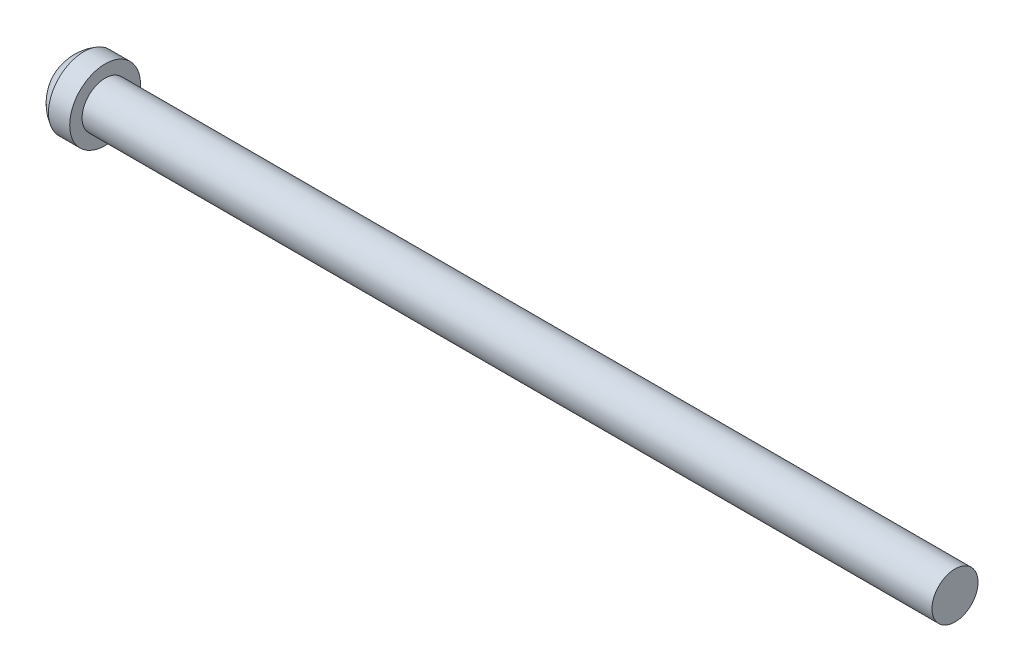
from build123d import *

# Parameters (mm, degrees)
SKIZZE3_R                       = 3.25
SKIZZE4_R                       = 5
AUFSATZ_LINEAR_AUSTRAGEN3_DEPTH = 3
KUPPEL1_FACE_RADIUS             = 5
KUPPEL1_HEIGHT                  = 3


with BuildPart() as part:
    # Austragung1: sweep along a path in Skizze2
    with BuildLine(Plane(origin=(-60, 0, 0), x_dir=(-1, 0, 0), z_dir=(0, 0, 1))) as austragung1_path:
        Line((60, 31.561162316), (-60, 31.561162316))
    # Skizze3 → Austragung1 (sweep)
    with BuildSketch(Plane(origin=(-120, 0, 0), x_dir=(0, -1, 0), z_dir=(-1, 0, 0))):
        with Locations((60, 5)):
            Circle(SKIZZE3_R)
    sweep(path=austragung1_path.line)

    # Skizze4 → Aufsatz-Linear austragen3 (add)
    with BuildSketch(Plane(origin=(-120, 0, 0), x_dir=(0, -1, 0), z_dir=(-1, 0, 0))):
        with Locations(Location((60, 5, 0), (0, 0, 90))):
            Circle(SKIZZE4_R)
    extrude(amount=AUFSATZ_LINEAR_AUSTRAGEN3_DEPTH)

    # Kuppel1: a dome of height H over a round flat face of radius A is a cap of a sphere of radius (A * A + H * H) / (2 * H)
    kuppel1_r = (KUPPEL1_FACE_RADIUS * KUPPEL1_FACE_RADIUS + KUPPEL1_HEIGHT * KUPPEL1_HEIGHT) / (2 * KUPPEL1_HEIGHT)
    kuppel1_base = Plane((-123, -60, 5), z_dir=(-1, 0, 0))
    with Locations(kuppel1_base.offset(KUPPEL1_HEIGHT - kuppel1_r)):
        kuppel1_ball = Sphere(kuppel1_r, mode=Mode.PRIVATE)
    add(split(kuppel1_ball, bisect_by=kuppel1_base, keep=Keep.TOP, mode=Mode.PRIVATE))


solid = part.part
